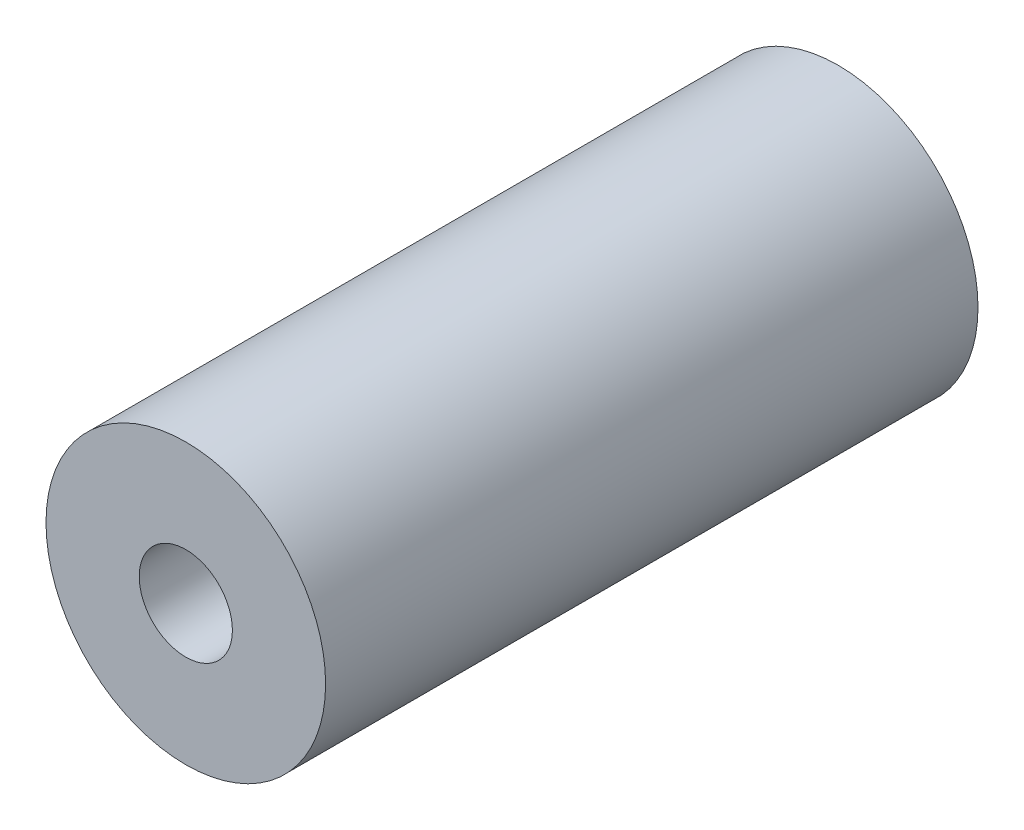
from build123d import *

# Parameters (mm, degrees)
SKETCH_1_R          = 3
EXTRUDE_1_DEPTH     = 14
CUT_EXTRUDE_1_REACH = 16.629
SKETCH_2_R          = 1


with BuildPart() as part:
    # 草图1 → 凸台-拉伸1 (new body)
    with BuildSketch(Plane.XY):
        Circle(SKETCH_1_R)
    extrude(amount=EXTRUDE_1_DEPTH)

    # 草图2 → 切除-拉伸1 (cut, up to next)
    with BuildSketch(Plane.XY.offset(14), mode=Mode.PRIVATE) as cut_extrude_1_sk1:
        Circle(SKETCH_2_R)
    cut_extrude_1_tool1 = extrude(cut_extrude_1_sk1.sketch, amount=-CUT_EXTRUDE_1_REACH, mode=Mode.PRIVATE) & part.part
    add(cut_extrude_1_tool1.solids().sort_by_distance((0, 0, 14))[0], mode=Mode.SUBTRACT)


solid = part.part
